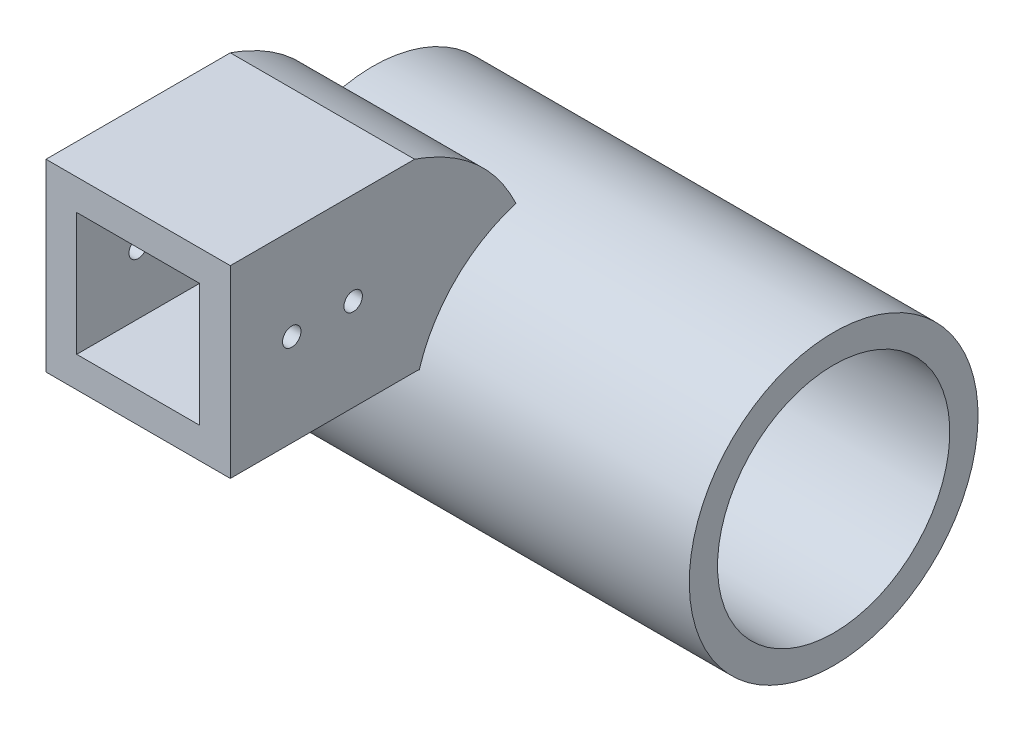
from build123d import *

# Parameters (mm, degrees)
SKETCH1_W           = 30
SKETCH1_H           = 30
SKETCH1_W_2         = 20
SKETCH1_H_2         = 20
BOSS_EXTRUDE1_DEPTH = 30
SKETCH21_R          = 1.5
CUT_EXTRUDE1_DEPTH  = 46
SKETCH22_W          = 30
SKETCH22_H          = 30
BOSS_EXTRUDE2_DEPTH = 5
BOSS_EXTRUDE4_DEPTH = 15
SKETCH26_R          = 23.5
BOSS_EXTRUDE5_DEPTH = 75
SKETCH27_R          = 18.9
CUT_EXTRUDE2_DEPTH  = 100.378046072
SKETCH28_R          = 18.9
BOSS_EXTRUDE7_DEPTH = 5
SKETCH29_R          = 1.5
SKETCH29_R_2        = 2.5
CUT_EXTRUDE3_DEPTH  = 8


with BuildPart() as part:
    # Sketch1 → Boss-Extrude1 (new body)
    with BuildSketch(Plane.XY):
        Rectangle(SKETCH1_W, SKETCH1_H)
        Rectangle(SKETCH1_W_2, SKETCH1_H_2, mode=Mode.SUBTRACT)
    extrude(amount=BOSS_EXTRUDE1_DEPTH)

    # Sketch21 → Cut-Extrude1 (cut, through all)
    with BuildSketch(Plane(origin=(15, 0, 0), x_dir=(0, 0, -1), z_dir=(1, 0, 0))):
        with Locations(Location((-10, 0, 0), (0, 0, 90))):
            Circle(SKETCH21_R)
        with Locations(Location((-20, 0, 0), (0, 0, 90))):
            Circle(SKETCH21_R)
    extrude(amount=-CUT_EXTRUDE1_DEPTH, mode=Mode.SUBTRACT)

    # Sketch22 → Boss-Extrude2 (add)
    with BuildSketch(Plane(origin=(0, 0, 0), x_dir=(-1, 0, 0), z_dir=(0, 0, -1))):
        Rectangle(SKETCH22_W, SKETCH22_H)
    extrude(amount=-BOSS_EXTRUDE2_DEPTH)

    # Sketch25 → Boss-Extrude4 (add, symmetric)
    with BuildSketch(Plane(origin=(0, 0, 0), x_dir=(0, 0, -1), z_dir=(1, 0, 0))):
        with BuildLine():
            Line((0, 15), (0, -15))
            ThreePointArc((0, -15), (1.913417162, -15.380602337), (3.535533906, -16.464466094))
            Line((3.535533906, -16.464466094), (22.852181054, -35.781113242))
            Line((22.852181054, -35.781113242), (36.994316678, -21.638977618))
            Line((36.994316678, -21.638977618), (17.67766953, -2.32233047))
            add(Edge.make_bspline(
                [(0, 15), (13.071207338, 10.453425887), (17.67766953, -2.32233047)],
                knots=[0, 0, 0, 1, 1, 1], degree=2))
        make_face()
    extrude(amount=BOSS_EXTRUDE4_DEPTH, both=True)

    # Sketch26 → Boss-Extrude5 (add)
    with BuildSketch(Plane.ZY.offset(15)):
        with Locations(Location((-23.205734445, -21.992531009, 0), (0, 0, 270))):
            Circle(SKETCH26_R)
    extrude(amount=-BOSS_EXTRUDE5_DEPTH)

    # Sketch27 → Cut-Extrude2 (cut, through all)
    with BuildSketch(Plane.ZY.offset(15)):
        with Locations(Location((-23.205734445, -21.992531009, 0), (0, 0, 270))):
            Circle(SKETCH27_R)
    extrude(amount=-CUT_EXTRUDE2_DEPTH, mode=Mode.SUBTRACT)

    # Sketch28 → Boss-Extrude7 (add)
    with BuildSketch(Plane.ZY.offset(15)):
        with Locations(Location((-23.205734445, -21.992531009, 0), (0, 0, 270))):
            Circle(SKETCH28_R)
    extrude(amount=-BOSS_EXTRUDE7_DEPTH)

    # Sketch29 → Cut-Extrude3 (cut)
    with BuildSketch(Plane.ZY.offset(15)):
        with Locations(Location((-34.448732265, -10.749533188, 0), (0, 0, 270))):
            Circle(SKETCH29_R)
        with Locations(Location((-19.090511627, -6.634310371, 0), (0, 0, 270))):
            Circle(SKETCH29_R)
        with Locations(Location((-7.847513807, -17.877308192, 0), (0, 0, 270))):
            Circle(SKETCH29_R)
        with Locations(Location((-11.962736624, -33.23552883, 0), (0, 0, 270))):
            Circle(SKETCH29_R)
        with Locations(Location((-27.320957262, -37.350751647, 0), (0, 0, 270))):
            Circle(SKETCH29_R)
        with Locations(Location((-38.563955083, -26.107753826, 0), (0, 0, 270))):
            Circle(SKETCH29_R)
        with Locations(Location((-29.923248866, -28.71004543, 0), (0, 0, 270))):
            Circle(SKETCH29_R_2)
    extrude(amount=-CUT_EXTRUDE3_DEPTH, mode=Mode.SUBTRACT)


solid = part.part
